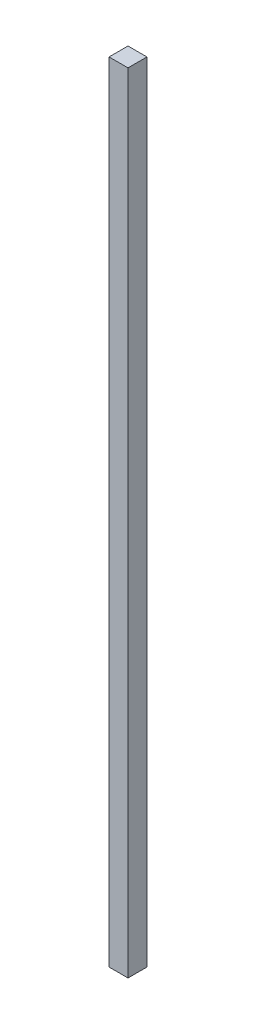
from build123d import *

# Parameters (mm, degrees)
SKETCH1_W           = 6
SKETCH1_H           = 6
BOSS_EXTRUDE1_DEPTH = 125


with BuildPart() as part:
    # Sketch1 → Boss-Extrude1 (new, symmetric)
    with BuildSketch(Plane(origin=(0, 0, 0), x_dir=(1, 0, 0), z_dir=(0, 1, 0))):
        Rectangle(SKETCH1_W, SKETCH1_H)
    extrude(amount=BOSS_EXTRUDE1_DEPTH, both=True)


solid = part.part
